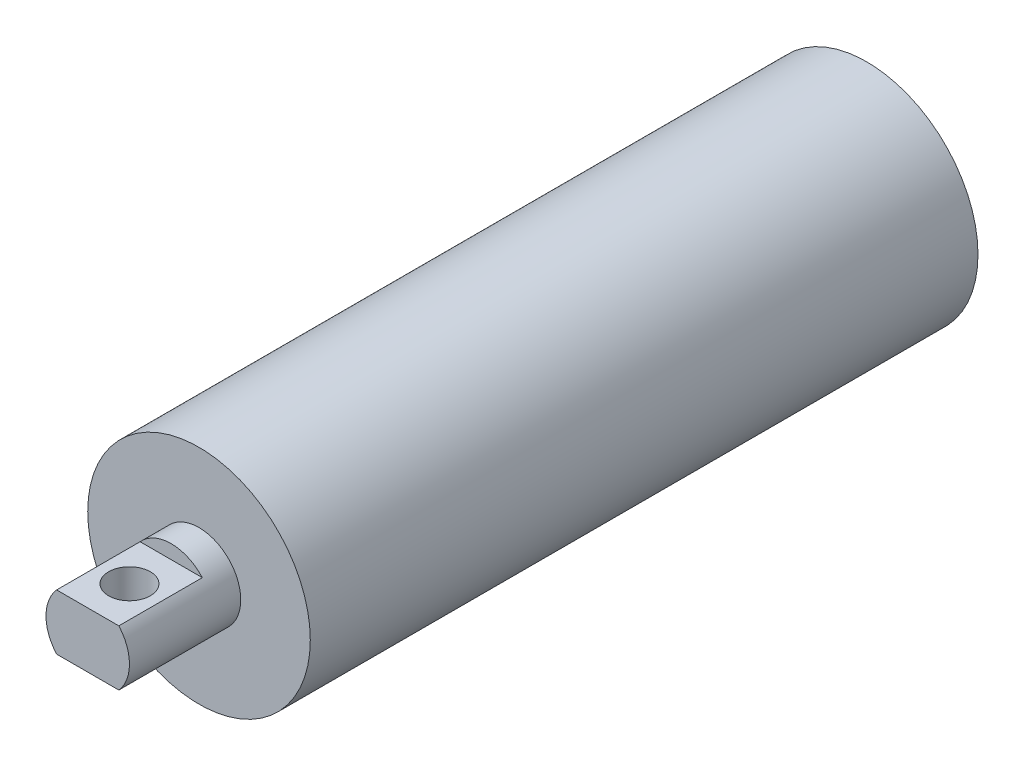
from build123d import *

# Parameters (mm, degrees)
SKETCH1_R               = 25.4
BOSS_EXTRUDE1_DEPTH     = 152.4
SKETCH2_R               = 9.525
BOSS_EXTRUDE2_DEPTH     = 25.4
SKETCH3_R               = 6.35
CUT_EXTRUDE1_DEPTH      = 100.33
CUT_EXTRUDE2_DEPTH      = 182.392282085
CUT_EXTRUDE2_DEPTH_BACK = 182.392282085
SKETCH4_W               = 19.05
SKETCH4_H               = 3.175
CUT_EXTRUDE3_DEPTH      = 183.389864028
CUT_EXTRUDE3_DEPTH_BACK = 183.389864028
SKETCH5_R               = 4.7625


with BuildPart() as part:
    # Sketch1 → Boss-Extrude1 (new body)
    with BuildSketch(Plane.XY):
        with Locations(Location((0, 0, 0), (0, 0, 180))):
            Circle(SKETCH1_R)
    extrude(amount=BOSS_EXTRUDE1_DEPTH)

    # Sketch2 → Boss-Extrude2 (add)
    with BuildSketch(Plane.XY.offset(152.4)):
        Circle(SKETCH2_R)
    extrude(amount=BOSS_EXTRUDE2_DEPTH)

    # Sketch3 → Cut-Extrude1 (cut)
    with BuildSketch(Plane(origin=(0, 0, 0), x_dir=(-1, 0, 0), z_dir=(0, 0, -1))):
        Circle(SKETCH3_R)
    extrude(amount=-CUT_EXTRUDE1_DEPTH, mode=Mode.SUBTRACT)

    # Sketch4 → Cut-Extrude2 (cut, two sides: drawn at the far end of the back side and taken through both)
    with BuildSketch(Plane(origin=(0, 0, 0), x_dir=(0, 0, -1), z_dir=(1, 0, 0)).offset(-CUT_EXTRUDE2_DEPTH_BACK)):
        with Locations((-168.275, 7.9375)):
            Rectangle(SKETCH4_W, SKETCH4_H)
        with Locations((-168.275, -7.9375)):
            Rectangle(SKETCH4_W, SKETCH4_H)
    extrude(amount=CUT_EXTRUDE2_DEPTH + CUT_EXTRUDE2_DEPTH_BACK, mode=Mode.SUBTRACT)

    # Sketch5 → Cut-Extrude3 (cut, two sides: drawn at the far end of the back side and taken through both)
    with BuildSketch(Plane.XZ.offset(6.35).offset(-CUT_EXTRUDE3_DEPTH_BACK)):
        with Locations(Location((0, 168.275, 0), (0, 0, 270))):
            Circle(SKETCH5_R)
    extrude(amount=CUT_EXTRUDE3_DEPTH + CUT_EXTRUDE3_DEPTH_BACK, mode=Mode.SUBTRACT)


solid = part.part
